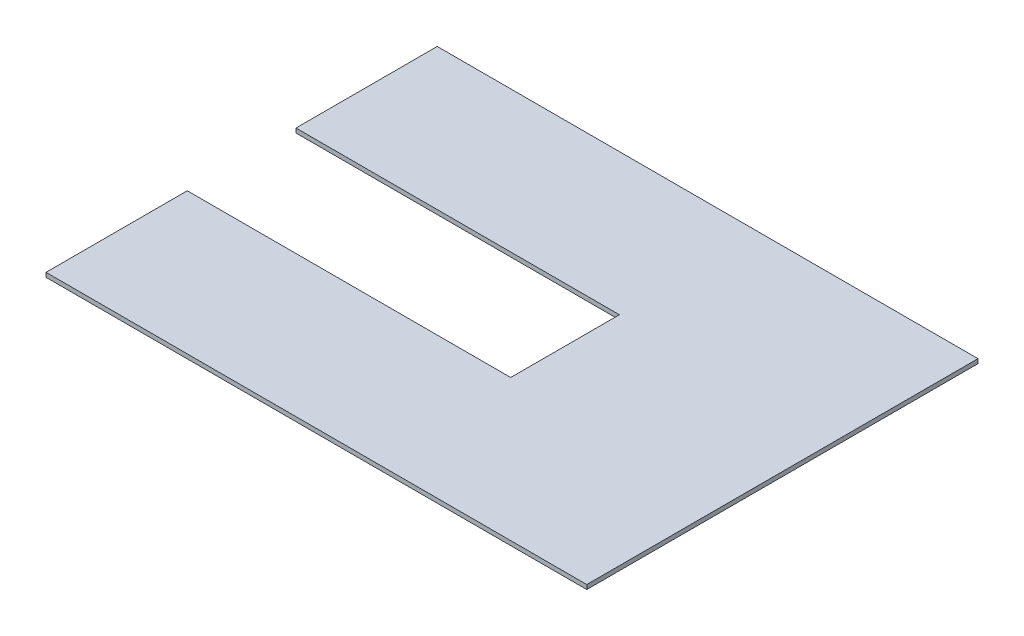
from build123d import *

# Parameters (mm, degrees)
BOSS_EXTRUDE1_DEPTH = 2


with BuildPart() as part:
    # Sketch1 → Boss-Extrude1 (new body)
    with BuildSketch(Plane(origin=(0, 0, 0), x_dir=(1, 0, 0), z_dir=(0, 1, 0))):
        Polygon((124.4, 90), (-124.4, 90), (-124.4, 25), (24.4, 25), (24.4, -25), (-124.4, -25), (-124.4, -90), (124.4, -90), align=None)
    extrude(amount=BOSS_EXTRUDE1_DEPTH)


solid = part.part
